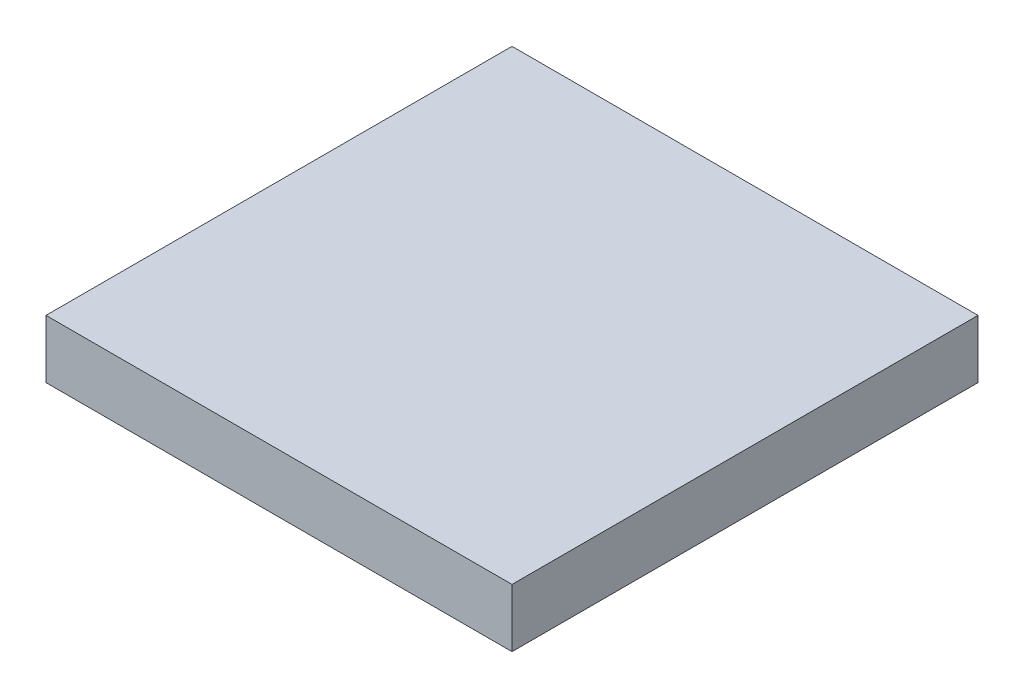
from build123d import *

# Parameters (mm, degrees)
SKETCH1_W           = 25.4
SKETCH1_H           = 25.4
BOSS_EXTRUDE1_DEPTH = 3.175


with BuildPart() as part:
    # Sketch1 → Boss-Extrude1 (new body)
    with BuildSketch(Plane(origin=(0, 0, 0), x_dir=(1, 0, 0), z_dir=(0, 1, 0))):
        with Locations((12.7, 12.7)):
            Rectangle(SKETCH1_W, SKETCH1_H)
    extrude(amount=BOSS_EXTRUDE1_DEPTH)


solid = part.part
